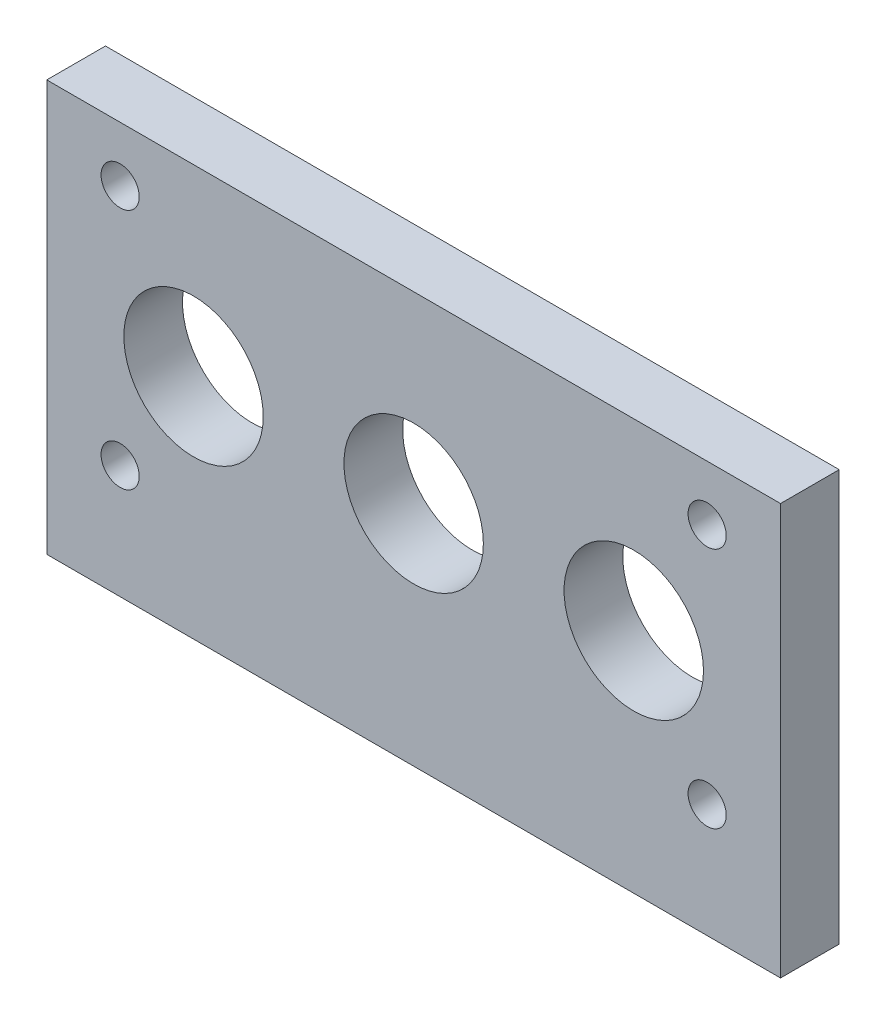
from build123d import *

# Parameters (mm, degrees)
IZIM1_W                     = 100
IZIM1_H                     = 56
IZIM1_R                     = 9.5
Y_KSEKLIK_EKSTR_ZYON1_DEPTH = 8
IZIM2_R                     = 2.6
KES_EKSTR_ZYON1_DEPTH       = 10


with BuildPart() as part:
    # Çizim1 → Yükseklik-Ekstrüzyon1 (new body)
    with BuildSketch(Plane.XY):
        with Locations((-2.031053151, 0.257686676)):
            Rectangle(IZIM1_W, IZIM1_H)
        with Locations((-32.031053151, 3.257686676)):
            Circle(IZIM1_R, mode=Mode.SUBTRACT)
        with Locations((27.968946849, 3.257686676)):
            Circle(IZIM1_R, mode=Mode.SUBTRACT)
        with Locations((-2.031053151, 3.257686676)):
            Circle(IZIM1_R, mode=Mode.SUBTRACT)
    extrude(amount=Y_KSEKLIK_EKSTR_ZYON1_DEPTH)

    # Çizim2 → Kes-Ekstrüzyon1 (cut)
    with BuildSketch(Plane(origin=(0, 0, 0), x_dir=(-1, 0, 0), z_dir=(0, 0, -1))):
        with Locations((-37.968946849, 20.757686676)):
            Circle(IZIM2_R)
        with Locations((-37.968946849, -12.242313324)):
            Circle(IZIM2_R)
        with Locations((42.031053151, -12.242313324)):
            Circle(IZIM2_R)
        with Locations((42.031053151, 20.757686676)):
            Circle(IZIM2_R)
    extrude(amount=-KES_EKSTR_ZYON1_DEPTH, mode=Mode.SUBTRACT)


solid = part.part
